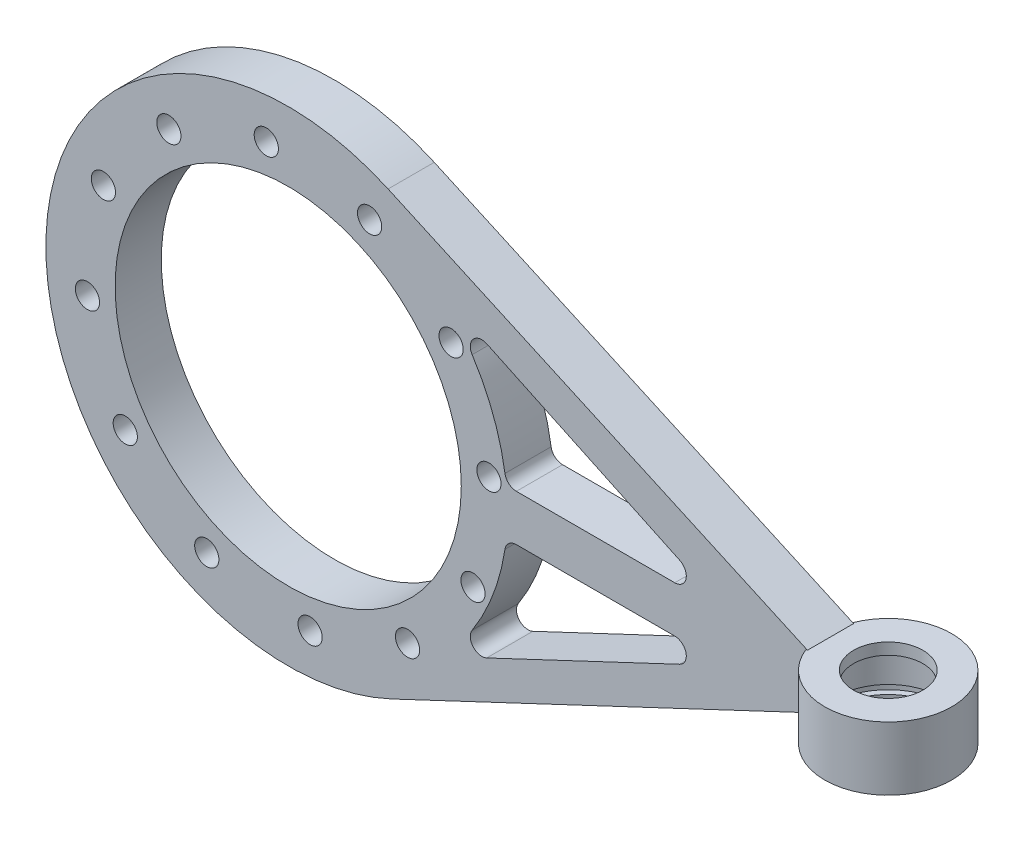
from build123d import *

# Parameters (mm, degrees)
SKETCH_1_R          = 42
EXTRUDE_1_DEPTH     = 3
SKETCH_2_W          = 11
SKETCH_2_H          = 11
EXTRUDE_2_DEPTH     = 4
SKETCH_4_R          = 6
CUT_EXTRUDE_1_DEPTH = 25
SKETCH_5_R          = 9
CUT_EXTRUDE_2_DEPTH = 9
CUT_EXTRUDE_START   = 8
SKETCH_6_R          = 10
SKETCH_6_R_2        = 9
CUT_EXTRUDE_3_DEPTH = 1.5
SKETCH_7_R          = 30
CUT_EXTRUDE_4_DEPTH = 30
FILLET_1_R          = 2
SKETCH_8_R          = 2.1
CUT_EXTRUDE_5_DEPTH = 120.624412224


with BuildPart() as part:
    # 草图1 → 凸台-拉伸1 (new body)
    with BuildSketch(Plane.XY):
        Circle(SKETCH_1_R)
    extrude(amount=EXTRUDE_1_DEPTH)



with BuildPart() as body_2:
    # 草图2 → 旋转1 (revolve)
    with BuildSketch(Plane.XY.offset(3), mode=Mode.PRIVATE) as revolve_1_sk:
        with Locations((94.5, -0.125)):
            Rectangle(SKETCH_2_W, SKETCH_2_H)
    revolve(revolve_1_sk.sketch.rotate(Axis((100, 22.717290725, 3), (0, -1, 0)), 270), axis=Axis((100, 22.717290725, 3), (0, -1, 0)))


with BuildPart() as part_1:
    add(part.part)

    add(body_2.part)  # 凸台-拉伸2 merges body 2
    # 草图3 → 凸台-拉伸2 (add, symmetric)
    with BuildSketch(Plane.XY.offset(3)):
        with BuildLine():
            Line((17.314737244, 38.264864748), (90, 5.375))
            Line((90, 5.375), (90, -4))
            Line((90, -4), (17.911593748, -37.989140678))
            ThreePointArc((17.911593748, -37.989140678), (-41.998713488, -0.328732965), (17.314737244, 38.264864748))
        make_face()
    extrude(amount=EXTRUDE_2_DEPTH, both=True)

    # 草图4 → 切除-拉伸1 (cut)
    with BuildSketch(Plane.XZ.offset(5.625)):
        with Locations(Location((100, 3, 0), (0, 0, 270))):
            Circle(SKETCH_4_R)
    extrude(amount=-CUT_EXTRUDE_1_DEPTH, mode=Mode.SUBTRACT)

    # 草图5 → 切除-拉伸2 (cut)
    with BuildSketch(Plane.XZ.offset(5.625)):
        with Locations(Location((100, 3, 0), (0, 0, 270))):
            Circle(SKETCH_5_R)
    extrude(amount=-CUT_EXTRUDE_2_DEPTH, mode=Mode.SUBTRACT)

    # 草图6 → 切除-拉伸3 (cut)
    # profile 1 of 2: a face of its own
    with BuildSketch(Plane.XZ.offset(-3.375).offset(CUT_EXTRUDE_START)):
        with Locations(Location((100, 3, 0), (0, 0, 270))):
            Circle(SKETCH_6_R)
        with Locations(Location((100, 3, 0), (0, 0, 270))):
            Circle(SKETCH_6_R_2, mode=Mode.SUBTRACT)
    # profile 2 of 2: a face of its own
    with BuildSketch(Plane.XZ.offset(-3.375).offset(CUT_EXTRUDE_START)):
        with Locations(Location((100, 3, 0), (0, 0, 270))):
            Circle(SKETCH_6_R_2)
    extrude(amount=-CUT_EXTRUDE_3_DEPTH, mode=Mode.SUBTRACT)

    # 草图7 → 切除-拉伸4 (cut)
    with BuildSketch(Plane.XY.offset(7)):
        Circle(SKETCH_7_R)
        with BuildLine():
            Line((26.356552806, -27.373931471), (75.930900201, -4))
            Line((75.930900201, -4), (37.788887255, -4))
            ThreePointArc((37.788887255, -4), (34.135678377, -16.695971422), (26.356552806, -27.373931471))
        make_face()
        with BuildLine():
            Line((37.788887255, 4), (75.930900201, 4))
            Line((75.930900201, 4), (26.356552806, 27.373931471))
            ThreePointArc((26.356552806, 27.373931471), (34.135678377, 16.695971422), (37.788887255, 4))
        make_face()
    extrude(amount=-CUT_EXTRUDE_4_DEPTH, mode=Mode.SUBTRACT)

    # 圆角1
    fillet_1_edges = [part_1.edges().sort_by_distance(p)[0] for p in [
        (37.788887255, 4, 3),
        (26.356552806, 27.373931471, 3),
        (75.930900201, 4, 3),
        (26.356552806, -27.373931471, 3),
        (37.788887255, -4, 3),
        (75.930900201, -4, 3),
    ]]
    fillet(fillet_1_edges, radius=FILLET_1_R)

    # 草图8 → 切除-拉伸5 (cut, through all)
    with BuildSketch(Plane.XY.offset(7)):
        with Locations((14.110790662, 32.029448745)):
            Circle(SKETCH_8_R)
        with Locations((-3.794421191, 34.793711613)):
            Circle(SKETCH_8_R)
        with Locations((-20.682920951, 28.235027553)):
            Circle(SKETCH_8_R)
        with Locations((-32.029448745, 14.110790662)):
            Circle(SKETCH_8_R)
        with Locations((-34.793711613, -3.794421191)):
            Circle(SKETCH_8_R)
        with Locations((-28.235027553, -20.682920951)):
            Circle(SKETCH_8_R)
        with Locations((-14.110790662, -32.029448745)):
            Circle(SKETCH_8_R)
        with Locations((3.794421191, -34.793711613)):
            Circle(SKETCH_8_R)
        with Locations((20.682920951, -28.235027553)):
            Circle(SKETCH_8_R)
        with Locations((32.029448745, -14.110790662)):
            Circle(SKETCH_8_R)
        with Locations((34.793711613, 3.794421191)):
            Circle(SKETCH_8_R)
        with Locations((28.235027553, 20.682920951)):
            Circle(SKETCH_8_R)
    extrude(amount=-CUT_EXTRUDE_5_DEPTH, mode=Mode.SUBTRACT)


solid = part_1.part
